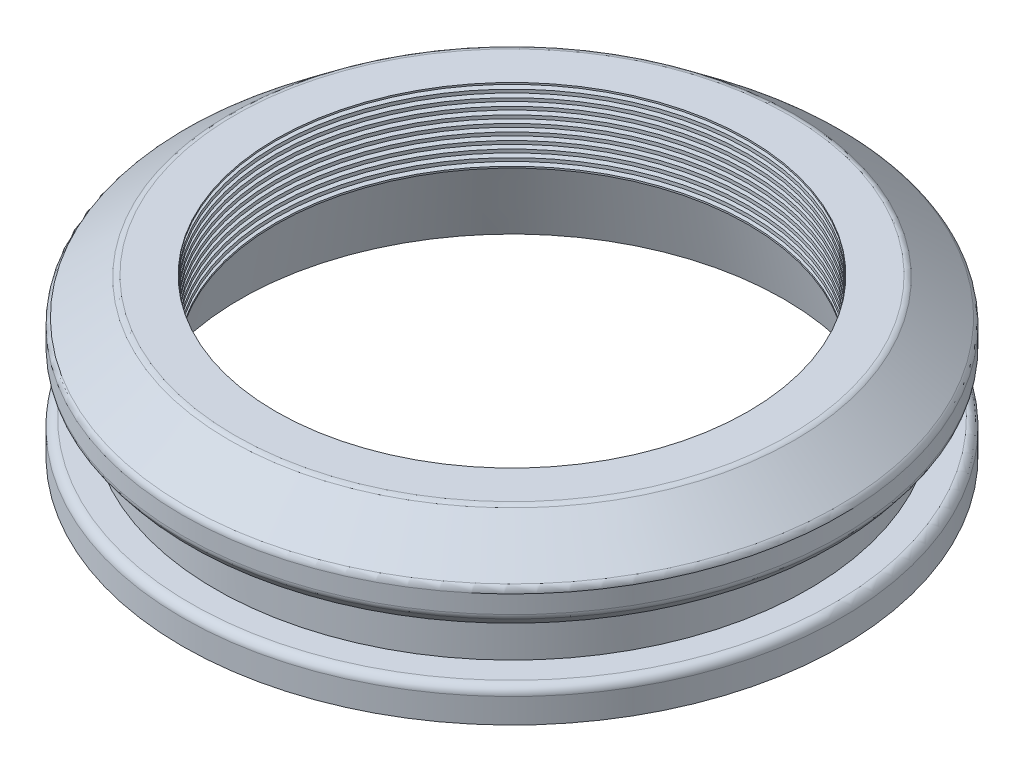
from build123d import *

# Parameters (mm, degrees)
FILLET1_R = 2.54
FILLET2_R = 2.54


with BuildPart() as part:
    # Sketch1 → Revolve1 (revolve)
    with BuildSketch(Plane.XY, mode=Mode.PRIVATE) as revolve1_sk:
        with BuildLine():
            Line((0, 10.16), (0, 0))
            Line((0, 0), (17.78, 0))
            Line((17.78, 0), (23.71876556, 25.4))
            Line((23.71876556, 25.4), (28.79876556, 25.4))
            Line((28.79876556, 25.4), (28.79876556, 25.908))
            Line((28.79876556, 25.908), (24.432867954, 26.289966547))
            ThreePointArc((24.432867954, 26.289966547), (24.201005512, 26.543), (24.432867954, 26.796033453))
            Line((24.432867954, 26.796033453), (28.79876556, 27.178))
            Line((28.79876556, 27.178), (28.79876556, 28.194))
            Line((28.79876556, 28.194), (24.432867954, 28.575966547))
            ThreePointArc((24.432867954, 28.575966547), (24.201005512, 28.829), (24.432867954, 29.082033453))
            Line((24.432867954, 29.082033453), (28.79876556, 29.464))
            Line((28.79876556, 29.464), (28.79876556, 30.48))
            Line((28.79876556, 30.48), (24.432867954, 30.861966547))
            ThreePointArc((24.432867954, 30.861966547), (24.201005512, 31.115), (24.432867954, 31.368033453))
            Line((24.432867954, 31.368033453), (28.79876556, 31.75))
            Line((28.79876556, 31.75), (28.79876556, 32.766))
            Line((28.79876556, 32.766), (24.432867954, 33.147966547))
            ThreePointArc((24.432867954, 33.147966547), (24.201005512, 33.401), (24.432867954, 33.654033453))
            Line((24.432867954, 33.654033453), (28.79876556, 34.036))
            Line((28.79876556, 34.036), (28.79876556, 35.052))
            Line((28.79876556, 35.052), (24.432867954, 35.433966547))
            ThreePointArc((24.432867954, 35.433966547), (24.201005512, 35.687), (24.432867954, 35.940033453))
            Line((24.432867954, 35.940033453), (28.79876556, 36.322))
            Line((28.79876556, 36.322), (28.79876556, 37.338))
            Line((28.79876556, 37.338), (24.432867954, 37.719966547))
            ThreePointArc((24.432867954, 37.719966547), (24.201005512, 37.973), (24.432867954, 38.226033453))
            Line((24.432867954, 38.226033453), (28.79876556, 38.608))
            Line((28.79876556, 38.608), (28.79876556, 39.624))
            Line((28.79876556, 39.624), (24.432867954, 40.005966547))
            ThreePointArc((24.432867954, 40.005966547), (24.201005512, 40.259), (24.432867954, 40.512033453))
            Line((24.432867954, 40.512033453), (28.79876556, 40.894))
            Line((28.79876556, 40.894), (28.79876556, 41.91))
            Line((28.79876556, 41.91), (24.432867954, 42.291966547))
            ThreePointArc((24.432867954, 42.291966547), (24.201005512, 42.545), (24.432867954, 42.798033453))
            Line((24.432867954, 42.798033453), (28.79876556, 43.18))
            Line((28.79876556, 43.18), (28.79876556, 44.196))
            Line((28.79876556, 44.196), (24.432867954, 44.577966547))
            ThreePointArc((24.432867954, 44.577966547), (24.201005512, 44.831), (24.432867954, 45.084033453))
            Line((24.432867954, 45.084033453), (28.79876556, 45.466))
            Line((28.79876556, 45.466), (28.79876556, 46.482))
            Line((28.79876556, 46.482), (24.432867954, 46.863966547))
            ThreePointArc((24.432867954, 46.863966547), (24.201005512, 47.117), (24.432867954, 47.370033453))
            Line((24.432867954, 47.370033453), (28.79876556, 47.752))
            Line((28.79876556, 47.752), (28.79876556, 48.26))
            Line((28.79876556, 48.26), (15.24, 48.26))
            Line((15.24, 48.26), (0, 36.240590949))
            Line((0, 36.240590949), (0, 28.620590949))
            Line((0, 28.620590949), (2.54, 25.4))
            Line((2.54, 25.4), (10.16, 25.4))
            Line((10.16, 25.4), (10.16, 10.16))
            Line((10.16, 10.16), (0, 10.16))
        make_face()
    revolve(revolve1_sk.sketch.rotate(Axis((101.6, 0, 0), (0, 1, 0)), 270), axis=Axis((101.6, 0, 0), (0, 1, 0)))

    # Fillet1
    fillet1_edges = [part.edges().sort_by_distance(p)[0] for p in [
        (101.6, 48.26, 86.36),
    ]]
    fillet(fillet1_edges, radius=FILLET1_R)

    # Fillet2
    fillet2_edges = [part.edges().sort_by_distance(p)[0] for p in [
        (101.6, 10.16, 101.6),
        (101.6, 25.4, 91.44),
        (101.6, 28.620590949, 101.6),
        (101.6, 36.240590949, 101.6),
    ]]
    fillet(fillet2_edges, radius=FILLET2_R)


solid = part.part
